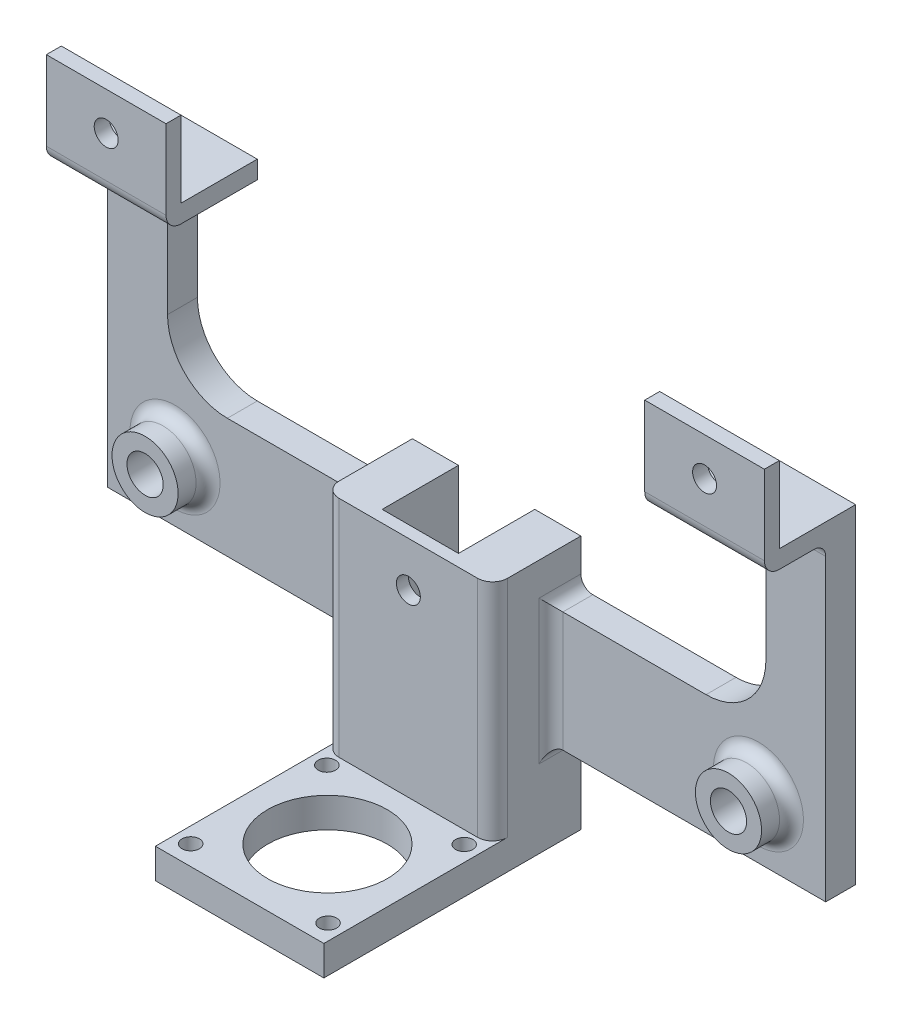
from build123d import *

# Parameters (mm, degrees)
SKETCH19_R             = 6.05
BOSS_EXTRUDE12_DEPTH   = 10
BOSS_EXTRUDE12_2_DEPTH = 10
SKETCH20_R             = 11.05
SKETCH20_R_2           = 6.05
SKETCH20_W             = 40
SKETCH20_H             = 31.5
BOSS_EXTRUDE13_DEPTH   = 20.5
SKETCH21_W             = 25.5
SKETCH21_H             = 25.5
SKETCH21_W_2           = 10.5
SKETCH21_H_2           = 22.1
CUT_EXTRUDE11_DEPTH    = 269.086739694
CUT_EXTRUDE12_REACH    = 171.324
SKETCH22_R             = 4
BOSS_EXTRUDE14_DEPTH   = 55
FILLET6_R              = 5
BOSS_EXTRUDE16_DEPTH   = 20
SKETCH27_R             = 2.9
SKETCH27_R_2           = 20
BOSS_EXTRUDE15_DEPTH   = 10
FILLET10_R             = 4
SKETCH31_R             = 4
CUT_EXTRUDE13_DEPTH    = 10


with BuildPart() as part:
    # Sketch19 → Boss-Extrude12 (new body)
    with BuildSketch(Plane.XY):
        with BuildLine():
            Line((28.15, 20), (80, 20))
            ThreePointArc((80, 20), (94.142135624, 25.857864376), (100, 40))
            Line((100, 40), (100, 77))
            ThreePointArc((100, 77), (97.949747468, 81.949747468), (93, 84))
            Line((93, 84), (80, 84))
            Line((80, 84), (80, 115.5))
            Line((80, 115.5), (120, 115.5))
            Line((120, 115.5), (120, -20))
            Line((120, -20), (12.75, -20))
            Line((12.75, -20), (12.75, 20))
            Line((12.75, 20), (12.75, 35))
            Line((12.75, 35), (28.15, 35))
            Line((28.15, 35), (28.15, 20))
        make_face()
        with Locations((97.5, 0)):
            Circle(SKETCH19_R, mode=Mode.SUBTRACT)
    extrude(amount=BOSS_EXTRUDE12_DEPTH)



with BuildPart() as body_2:
    # Sketch19 → Boss-Extrude12 2 (new body)
    with BuildSketch(Plane.XY):
        with BuildLine():
            Line((-120, -20), (-12.75, -20))
            Line((-12.75, -20), (-12.75, 20))
            Line((-12.75, 20), (-12.75, 35))
            Line((-12.75, 35), (-28.15, 35))
            Line((-28.15, 35), (-28.15, 20))
            Line((-28.15, 20), (-80, 20))
            ThreePointArc((-80, 20), (-94.142135624, 25.857864376), (-100, 40))
            Line((-100, 40), (-100, 77))
            ThreePointArc((-100, 77), (-97.949747468, 81.949747468), (-93, 84))
            Line((-93, 84), (-80, 84))
            Line((-80, 84), (-80, 115.5))
            Line((-80, 115.5), (-120, 115.5))
            Line((-120, 115.5), (-120, -20))
        make_face()
        with Locations((-97.5, 0)):
            Circle(SKETCH19_R, mode=Mode.SUBTRACT)
    extrude(amount=BOSS_EXTRUDE12_2_DEPTH)


with BuildPart() as part_1:
    add(part.part)

    add(body_2.part)  # Boss-Extrude13 merges body 2
    # Sketch20 → Boss-Extrude13 (add)
    # profile 1 of 4: a face of its own
    with BuildSketch(Plane.XY.offset(10)):
        with Locations((-97.5, 0)):
            Circle(SKETCH20_R)
        with Locations((-97.5, 0)):
            Circle(SKETCH20_R_2, mode=Mode.SUBTRACT)
    # profile 2 of 4: a face of its own
    with BuildSketch(Plane.XY.offset(10)):
        with Locations((97.5, 0)):
            Circle(SKETCH20_R)
        with Locations((97.5, 0)):
            Circle(SKETCH20_R_2, mode=Mode.SUBTRACT)
    # profile 3 of 4: a face of its own
    with BuildSketch(Plane.XY.offset(10)):
        with Locations((-100, 99.75)):
            Rectangle(SKETCH20_W, SKETCH20_H)
    # profile 4 of 4: a face of its own
    with BuildSketch(Plane.XY.offset(10)):
        with Locations((100, 99.75)):
            Rectangle(SKETCH20_W, SKETCH20_H)
    extrude(amount=BOSS_EXTRUDE13_DEPTH)

    # Sketch21 → Cut-Extrude11 (cut, through all)
    with BuildSketch(Plane(origin=(120, 0, 0), x_dir=(0, 0, -1), z_dir=(1, 0, 0))):
        with Locations((-12.75, 102.75)):
            Rectangle(SKETCH21_W, SKETCH21_H)
        with Locations((-25.25, 0)):
            Rectangle(SKETCH21_W_2, SKETCH21_H_2)
    extrude(amount=-CUT_EXTRUDE11_DEPTH, mode=Mode.SUBTRACT)

    # Sketch22 → Cut-Extrude12 (cut, up to next)
    with BuildSketch(Plane.XY.offset(30.5), mode=Mode.PRIVATE) as cut_extrude12_sk1:
        with Locations((-100, 102.75)):
            Circle(SKETCH22_R)
    cut_extrude12_tool1 = extrude(cut_extrude12_sk1.sketch, amount=-CUT_EXTRUDE12_REACH, mode=Mode.PRIVATE) & part_1.part
    # Sketch22 → Cut-Extrude12 (cut, up to next)
    with BuildSketch(Plane.XY.offset(30.5), mode=Mode.PRIVATE) as cut_extrude12_sk2:
        with Locations((100, 102.75)):
            Circle(SKETCH22_R)
    cut_extrude12_tool2 = extrude(cut_extrude12_sk2.sketch, amount=-CUT_EXTRUDE12_REACH, mode=Mode.PRIVATE) & part_1.part
    add(cut_extrude12_tool1.solids().sort_by_distance((-100, 102.75, 30.5))[0], mode=Mode.SUBTRACT)
    add(cut_extrude12_tool2.solids().sort_by_distance((100, 102.75, 30.5))[0], mode=Mode.SUBTRACT)

    # Sketch23 → Boss-Extrude14 (add)
    with BuildSketch(Plane.XZ.offset(20)):
        Polygon((-12.75, 10), (-28.15, 10), (-28.15, 29.5), (28.15, 29.5), (28.15, 10), (12.75, 10), (12.75, 25.5), (-12.75, 25.5), align=None)
    extrude(amount=-BOSS_EXTRUDE14_DEPTH)

    # Fillet6
    fillet6_edges = [part_1.edges().sort_by_distance(p)[0] for p in [
        (-100, 84, 30.5),
        (100, 84, 30.5),
        (28.15, 7.5, 29.5),
        (-28.15, 7.5, 29.5),
    ]]
    fillet(fillet6_edges, radius=FILLET6_R)

    # Sketch28 → Boss-Extrude16 (add)
    with BuildSketch(Plane.XZ.offset(20)):
        with BuildLine():
            Line((-28.15, 0), (-28.15, 24.5))
            ThreePointArc((-28.15, 24.5), (-26.685533906, 28.035533906), (-23.15, 29.5))
            Line((-23.15, 29.5), (23.15, 29.5))
            ThreePointArc((23.15, 29.5), (26.685533906, 28.035533906), (28.15, 24.5))
            Line((28.15, 24.5), (28.15, 0))
            Line((28.15, 0), (12.75, 0))
            Line((12.75, 0), (12.75, 25.5))
            Line((12.75, 25.5), (-12.75, 25.5))
            Line((-12.75, 25.5), (-12.75, 0))
            Line((-12.75, 0), (-28.15, 0))
        make_face()
    extrude(amount=BOSS_EXTRUDE16_DEPTH)

    # Sketch27 → Boss-Extrude15 (add)
    with BuildSketch(Plane(origin=(0, -40, 0), x_dir=(1, 0, 0), z_dir=(0, 1, 0))):
        Polygon((-12.75, 0), (-12.75, -25.5), (12.75, -25.5), (12.75, 0), (28.15, 0), (28.15, -85.9), (-28.15, -85.9), (-28.15, 0), align=None)
        with Locations((-22.95, -79.3)):
            Circle(SKETCH27_R, mode=Mode.SUBTRACT)
        with Locations((22.95, -79.3)):
            Circle(SKETCH27_R, mode=Mode.SUBTRACT)
        with Locations((22.95, -33.8)):
            Circle(SKETCH27_R, mode=Mode.SUBTRACT)
        with Locations((-22.95, -33.8)):
            Circle(SKETCH27_R, mode=Mode.SUBTRACT)
        with Locations((0, -56.55)):
            Circle(SKETCH27_R_2, mode=Mode.SUBTRACT)
    extrude(amount=-BOSS_EXTRUDE15_DEPTH)

    # Fillet10
    fillet10_edges = [part_1.edges().sort_by_distance(p)[0] for p in [
        (28.15, 20, 5),
        (-28.15, 20, 5),
        (-28.15, 0, 10),
        (28.15, 0, 10),
        (86.45, 0, 10),
        (-108.55, 0, 10),
        (-106.5, 84, 10),
        (106.5, 84, 10),
        (-28.15, -20, 5),
        (28.15, -20, 5),
    ]]
    fillet(fillet10_edges, radius=FILLET10_R)

    # Sketch31 → Cut-Extrude13 (cut)
    with BuildSketch(Plane.XY.offset(29.5)):
        with Locations((0, 20)):
            Circle(SKETCH31_R)
    extrude(amount=-CUT_EXTRUDE13_DEPTH, mode=Mode.SUBTRACT)


solid = part_1.part
